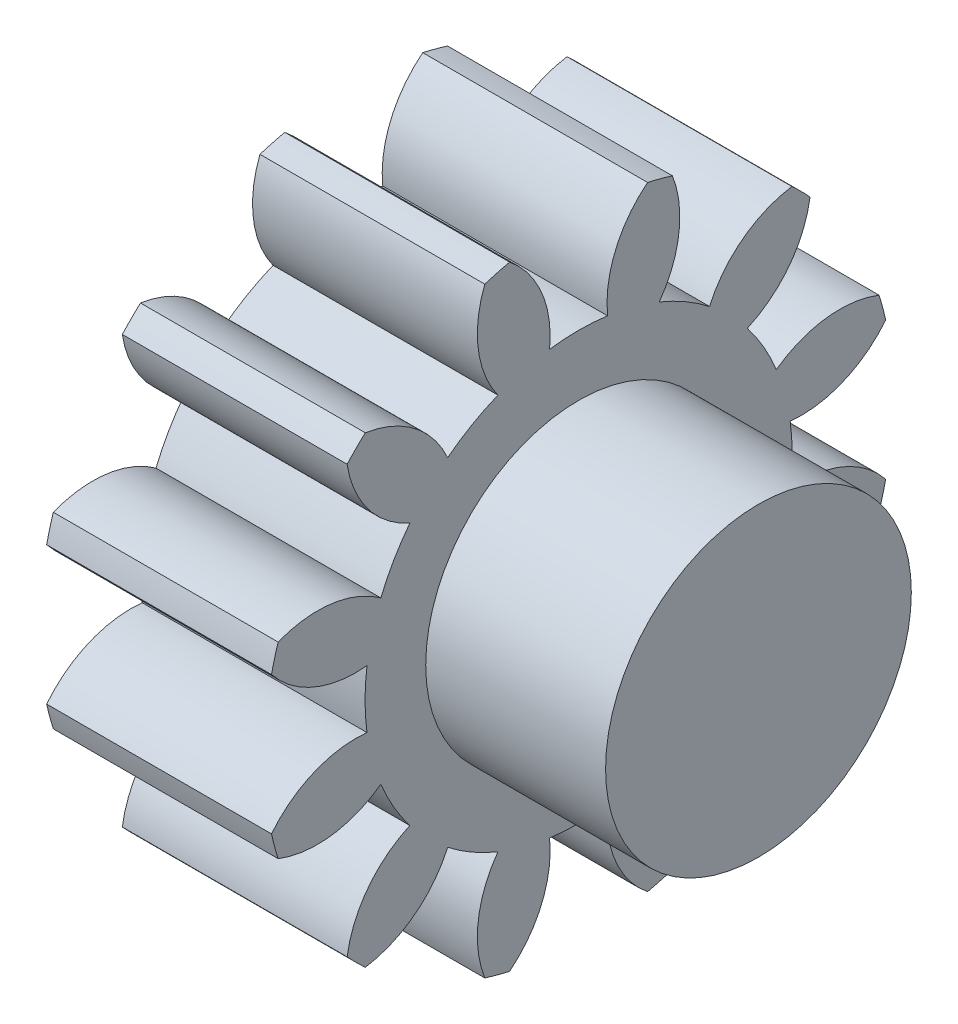
from build123d import *

# Parameters (mm, degrees)
BASPROSKE_W                  = 12.5
BASPROSKE_H                  = 17.5
TOOTHCUT_DEPTH               = 28.726341266
TEETHCUTS_COUNT              = 12
TEETHCUTS_ANGLE              = 330
BORSKE_R                     = 0.75
BORE_DEPTH                   = 50.0000508
ENL_V_MAT_EXTRU_2_DEPTH      = 10
ENL_V_MAT_EXTRU_2_DEPTH_BACK = 60
ESQUISSE1_R                  = 5
ESQUISSE2_R                  = 8.5
BOSS_EXTRU_1_DEPTH           = 10


with BuildPart() as part:
    # BasProSke → Base-Revolve (revolve)
    with BuildSketch(Plane(origin=(0, 0, 0), x_dir=(1, 0, 0), z_dir=(0, 1, 0)), mode=Mode.PRIVATE) as base_revolve_sk:
        with Locations((6.25, 8.75)):
            Rectangle(BASPROSKE_W, BASPROSKE_H)
    revolve(base_revolve_sk.sketch.rotate(Axis((-10, 0, 0), (1, 0, 0)), 180), axis=Axis((-10, 0, 0), (1, 0, 0)))

    # TooCutSke → ToothCut (cut, through all)
    with BuildSketch(Plane(origin=(0, 0, 0), x_dir=(0, 0, -1), z_dir=(1, 0, 0))):
        with BuildLine():
            ThreePointArc((1.612970859, 11.763936459), (0, 11.874), (-1.612970859, 11.763936459))
            ThreePointArc((-1.612970859, 11.763936459), (-2.052105863, 14.718225349), (-3.861172246, 17.094765107))
            ThreePointArc((-3.861172246, 17.094765107), (0, 17.5254), (3.861172246, 17.094765107))
            ThreePointArc((3.861172246, 17.094765107), (2.052105863, 14.718225349), (1.612970859, 11.763936459))
        make_face()
    toothcut = extrude(amount=TOOTHCUT_DEPTH, mode=Mode.SUBTRACT)

    # TeethCuts: ToothCut ×12 about axis
    teethcuts_axis = Axis((-10, 0, 0), (1, 0, 0))
    for i in range(1, TEETHCUTS_COUNT):
        add(toothcut.rotate(teethcuts_axis, i * TEETHCUTS_ANGLE / (TEETHCUTS_COUNT - 1)), mode=Mode.SUBTRACT)

    # BorSke → Bore (cut, symmetric)
    with BuildSketch(Plane(origin=(0, 0, 0), x_dir=(0, 0, -1), z_dir=(1, 0, 0))):
        with Locations(Location((0, 0, 0), (0, 0, 180))):
            Circle(BORSKE_R)
    extrude(amount=BORE_DEPTH, both=True, mode=Mode.SUBTRACT)

    # Esquisse1 → Enlèv. mat.-Extru.2 (cut, two sides: drawn at the far end of the back side and taken through both)
    with BuildSketch(Plane(origin=(12.5, 0, 0), x_dir=(0, 0, -1), z_dir=(1, 0, 0)).offset(-ENL_V_MAT_EXTRU_2_DEPTH_BACK)):
        with Locations(Location((0, 0, 0), (0, 0, 180))):
            Circle(ESQUISSE1_R)
    extrude(amount=ENL_V_MAT_EXTRU_2_DEPTH + ENL_V_MAT_EXTRU_2_DEPTH_BACK, mode=Mode.SUBTRACT)

    # Esquisse2 → Boss.-Extru.1 (add)
    with BuildSketch(Plane(origin=(12.5, 0, 0), x_dir=(0, 0, -1), z_dir=(1, 0, 0))):
        with Locations(Location((0, 0, 0), (0, 0, 180))):
            Circle(ESQUISSE2_R)
    extrude(amount=BOSS_EXTRU_1_DEPTH)


solid = part.part
